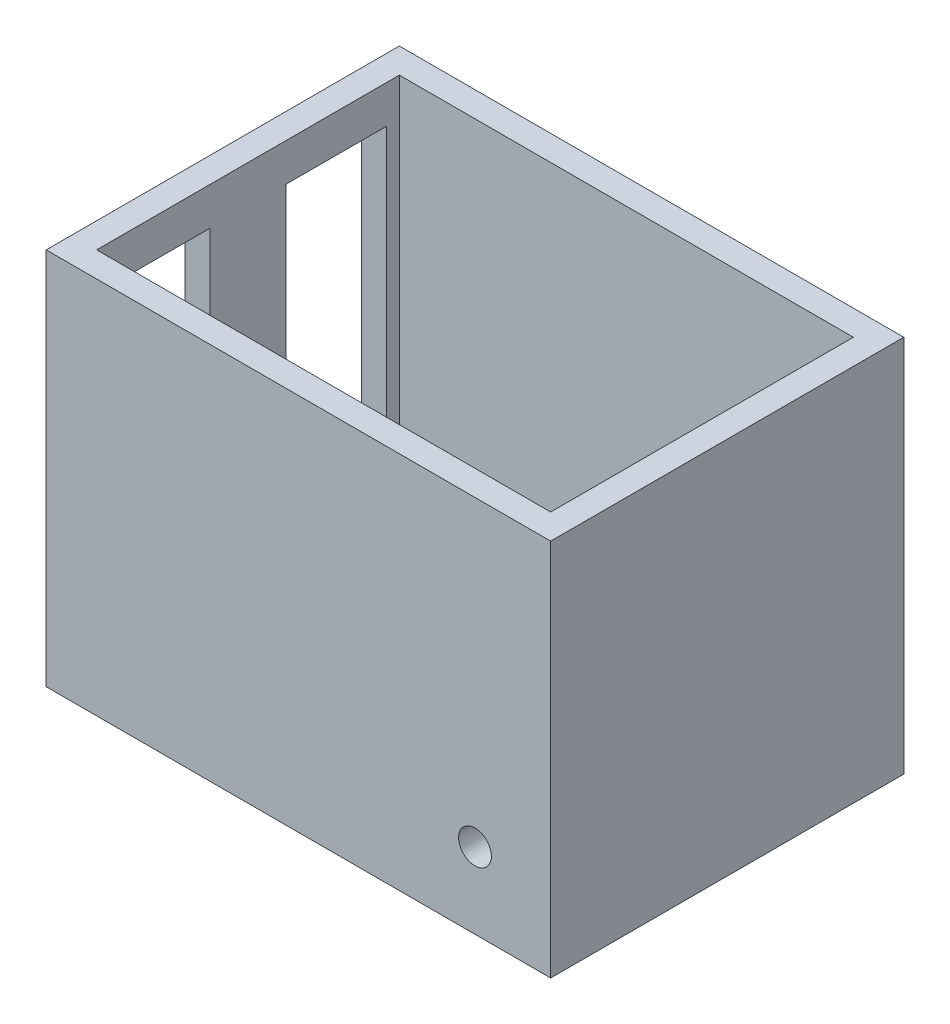
from build123d import *

# Parameters (mm, degrees)
SKETCH2_W           = 101.6
SKETCH2_H           = 71.12
BOSS_EXTRUDE1_DEPTH = 76.2
SKETCH3_W           = 91.44
SKETCH3_H           = 60.96
CUT_EXTRUDE5_DEPTH  = 71.12
SKETCH5_R           = 3.302
CUT_EXTRUDE6_DEPTH  = 7.62
SKETCH7_R           = 5.08
CUT_EXTRUDE8_DEPTH  = 7.62
SKETCH8_W           = 20.32
SKETCH8_H           = 60.96
CUT_EXTRUDE9_DEPTH  = 7.62


with BuildPart() as part:
    # Sketch2 → Boss-Extrude1 (new body)
    with BuildSketch(Plane(origin=(0, 0, 0), x_dir=(1, 0, 0), z_dir=(0, 1, 0))):
        with Locations((6.092485814, -6.347086588)):
            Rectangle(SKETCH2_W, SKETCH2_H)
    extrude(amount=BOSS_EXTRUDE1_DEPTH)

    # Sketch3 → Cut-Extrude5 (cut)
    with BuildSketch(Plane(origin=(0, 76.2, 0), x_dir=(1, 0, 0), z_dir=(0, 1, 0))):
        with Locations((6.092485814, -6.347086588)):
            Rectangle(SKETCH3_W, SKETCH3_H)
    extrude(amount=-CUT_EXTRUDE5_DEPTH, mode=Mode.SUBTRACT)

    # Sketch5 → Cut-Extrude6 (cut)
    with BuildSketch(Plane.XY.offset(41.907086588)):
        with Locations((41.652485814, 15.24)):
            Circle(SKETCH5_R)
    extrude(amount=-CUT_EXTRUDE6_DEPTH, mode=Mode.SUBTRACT)

    # Sketch7 → Cut-Extrude8 (cut)
    with BuildSketch(Plane(origin=(0, 5.08, 0), x_dir=(1, 0, 0), z_dir=(0, 1, 0))):
        with Locations(Location((-12.957514186, -3.807086588, 0), (0, 0, 270))):
            Circle(SKETCH7_R)
        with Locations(Location((25.142485814, -6.347086588, 0), (0, 0, 270))):
            Circle(SKETCH7_R)
    extrude(amount=-CUT_EXTRUDE8_DEPTH, mode=Mode.SUBTRACT)

    # Sketch8 → Cut-Extrude9 (cut)
    with BuildSketch(Plane.ZY.offset(44.707514186)):
        with Locations((-11.432913412, 38.1)):
            Rectangle(SKETCH8_W, SKETCH8_H)
        with Locations((24.127086588, 38.1)):
            Rectangle(SKETCH8_W, SKETCH8_H)
    extrude(amount=-CUT_EXTRUDE9_DEPTH, mode=Mode.SUBTRACT)


solid = part.part
